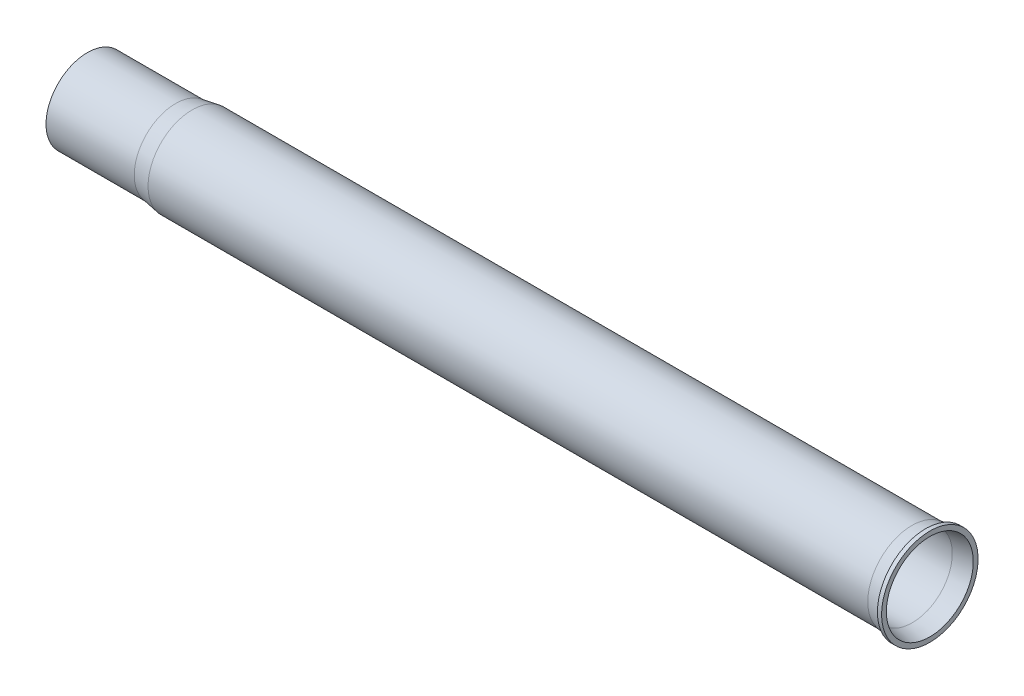
from build123d import *


with BuildPart() as part:
    # Esquisse1 → Base-Révolution (revolve)
    with BuildSketch(Plane.XY, mode=Mode.PRIVATE) as base_r_volution_sk:
        Polygon((0, 15), (32, 15), (38, 16), (299, 16), (304, 17), (304, 17.5), (305.5, 17.5), (305.5, 15.770294146), (299.14852927, 14.5), (38.124143795, 14.5), (32.124143795, 13.5), (0, 13.5), align=None)
    revolve(base_r_volution_sk.sketch.rotate(Axis((0, 0, 0), (1, 0, 0)), 90), axis=Axis((0, 0, 0), (1, 0, 0)))


solid = part.part
